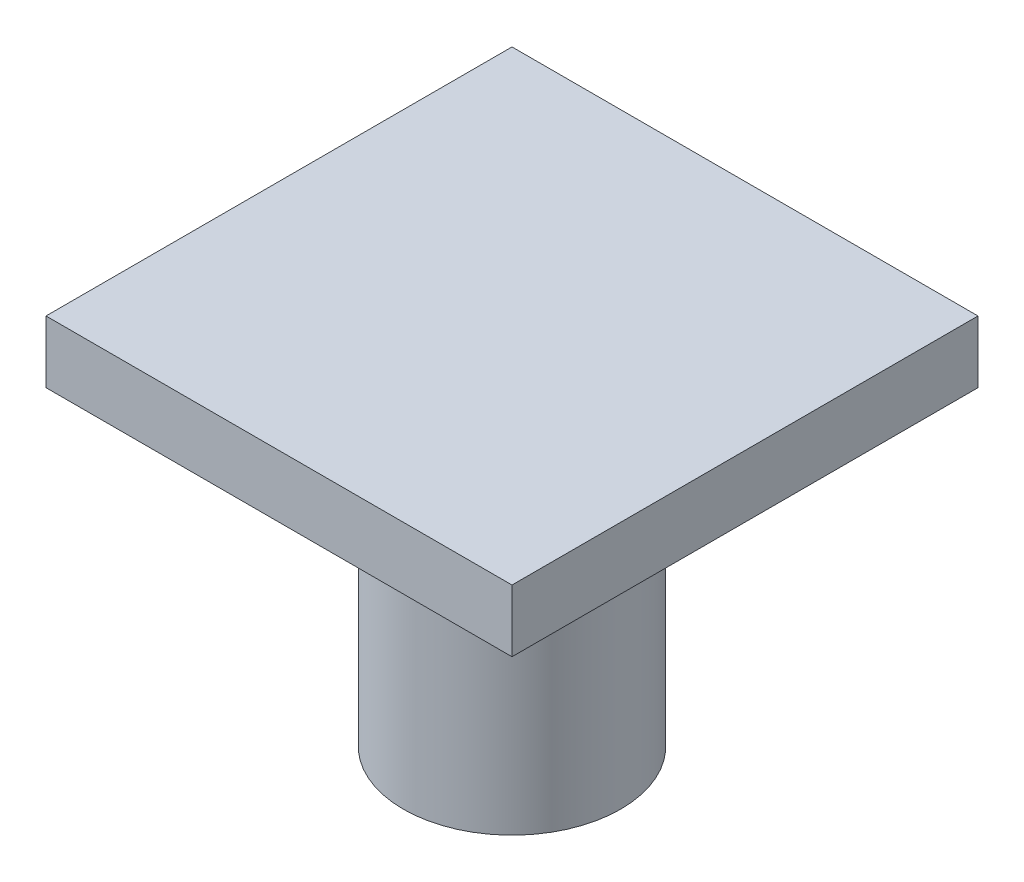
from build123d import *

# Parameters (mm, degrees)
SKETCH2_W           = 15
SKETCH2_H           = 15
BOSS_EXTRUDE1_DEPTH = 2
SKETCH3_R           = 3.5
SKETCH3_R_2         = 2.5
BOSS_EXTRUDE2_DEPTH = 10
FILLET1_R           = 1
FILLET2_R           = 1


with BuildPart() as part:
    # Sketch2 → Boss-Extrude1 (new body)
    with BuildSketch(Plane(origin=(0, 0, 0), x_dir=(1, 0, 0), z_dir=(0, 1, 0))):
        Rectangle(SKETCH2_W, SKETCH2_H)
    extrude(amount=BOSS_EXTRUDE1_DEPTH)

    # Sketch3 → Boss-Extrude2 (add)
    with BuildSketch(Plane.XZ):
        with Locations(Location((0, 0, 0), (0, 0, 270))):
            Circle(SKETCH3_R)
        with Locations(Location((0, 0, 0), (0, 0, 270))):
            Circle(SKETCH3_R_2, mode=Mode.SUBTRACT)
    extrude(amount=BOSS_EXTRUDE2_DEPTH)

    # Fillet1
    fillet1_edges = [part.edges().sort_by_distance(p)[0] for p in [
        (0, 0, 3.5),
    ]]
    fillet(fillet1_edges, radius=FILLET1_R)

    # Fillet2
    fillet2_edges = [part.edges().sort_by_distance(p)[0] for p in [
        (0, 0, 2.5),
    ]]
    fillet(fillet2_edges, radius=FILLET2_R)


solid = part.part
